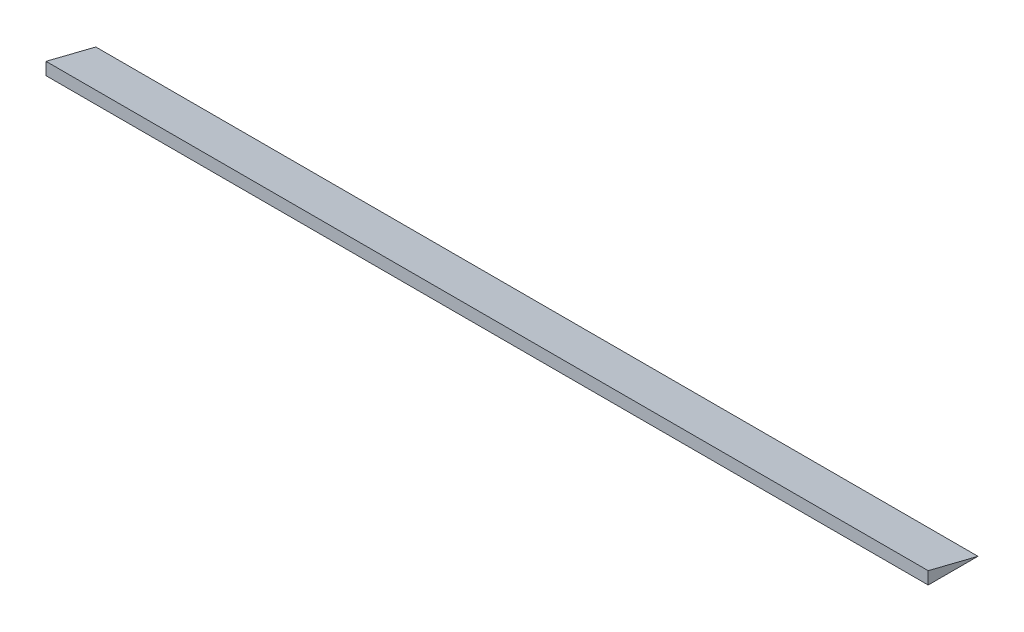
from build123d import *

# Parameters (mm, degrees)
BOSS_EXTRUDE1_DEPTH = 675


with BuildPart() as part:
    # Sketch1 → Boss-Extrude1 (new body)
    with BuildSketch(Plane(origin=(0, 0, 0), x_dir=(0, 0, -1), z_dir=(1, 0, 0))):
        Polygon((0, 0), (38.1, 0), (0, 9.525), align=None)
    extrude(amount=BOSS_EXTRUDE1_DEPTH)


solid = part.part
